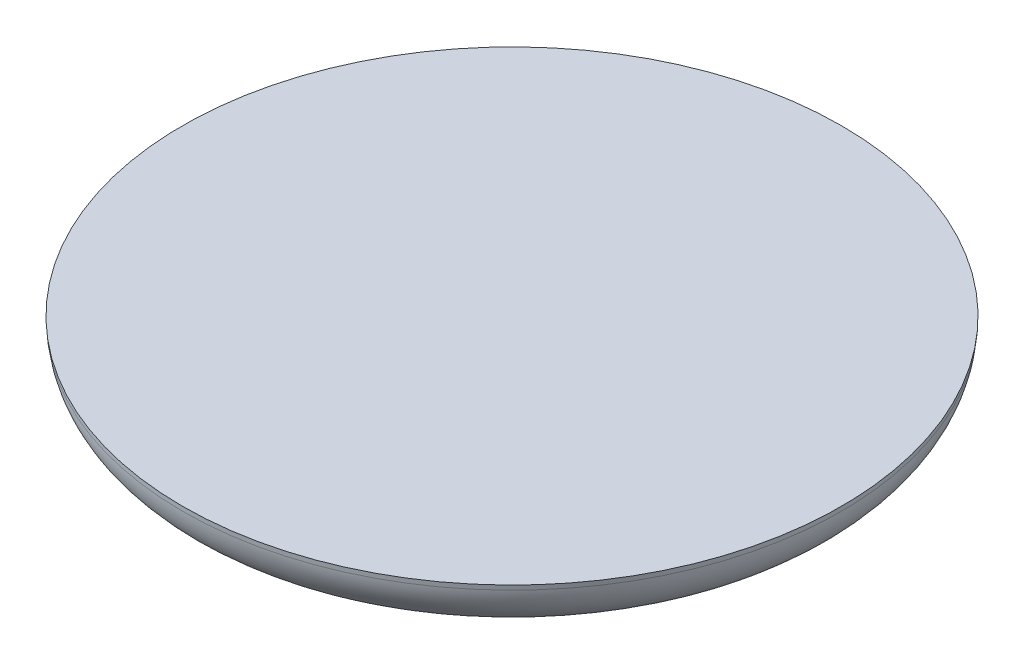
from build123d import *

# Parameters (mm, degrees)
SKETCH1_R           = 38.1
BOSS_EXTRUDE1_DEPTH = 6.35
BOSS_EXTRUDE1_DRAFT = -5
FILLET1_R           = 6.35


with BuildPart() as part:
    # Sketch1 → Boss-Extrude1 (with draft: the straight prism first)
    with BuildSketch(Plane(origin=(0, 0, 0), x_dir=(1, 0, 0), z_dir=(0, 1, 0))):
        Circle(SKETCH1_R)
    extrude(amount=BOSS_EXTRUDE1_DEPTH)
    # Boss-Extrude1: the draft: its side faces are tilted about the plane it starts from
    boss_extrude1_sides = [part.faces().sort_by_distance(p)[0] for p in [
        (-38.1, 3.175, 0),
    ]]
    draft(boss_extrude1_sides, Plane(origin=(0, 0, 0), x_dir=(1, 0, 0), z_dir=(0, 1, 0)), BOSS_EXTRUDE1_DRAFT)

    # Fillet1
    fillet1_edges = [part.edges().sort_by_distance(p)[0] for p in [
        (-38.1, 0, 0),
    ]]
    fillet(fillet1_edges, radius=FILLET1_R)


solid = part.part
